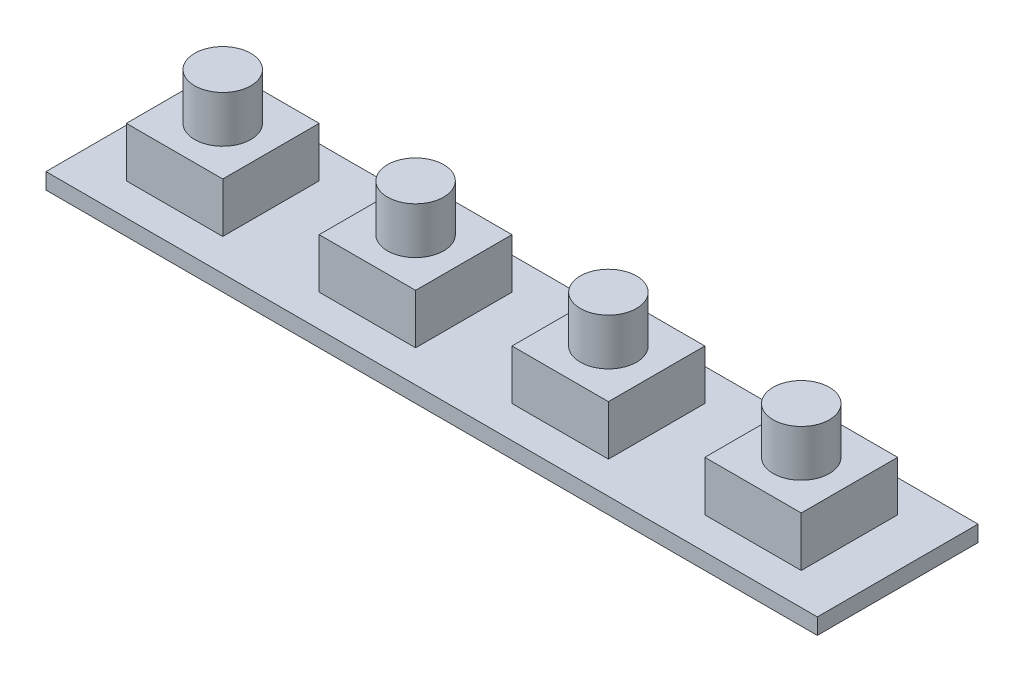
from build123d import *

# Parameters (mm, degrees)
SKETCH1_W           = 48
SKETCH1_H           = 10
BOSS_EXTRUDE1_DEPTH = 1
SKETCH2_W           = 6
SKETCH2_H           = 6
BOSS_EXTRUDE2_DEPTH = 3
SKETCH2_2_W         = 6
SKETCH2_2_H         = 6
BOSS_EXTRUDE3_DEPTH = 3.1
SKETCH4_R           = 1.75
BOSS_EXTRUDE4_DEPTH = 2.9


with BuildPart() as part:
    # Sketch1 → Boss-Extrude1 (new body)
    with BuildSketch(Plane(origin=(0, 0, 0), x_dir=(1, 0, 0), z_dir=(0, 1, 0))):
        Rectangle(SKETCH1_W, SKETCH1_H)
    extrude(amount=BOSS_EXTRUDE1_DEPTH)

    # Sketch2 → Boss-Extrude2 (add)
    with BuildSketch(Plane(origin=(0, 1, 0), x_dir=(1, 0, 0), z_dir=(0, 1, 0))):
        with Locations((-6, 0)):
            Rectangle(SKETCH2_W, SKETCH2_H)
        with Locations((-18, 0)):
            Rectangle(SKETCH2_W, SKETCH2_H)
        with Locations((6, 0)):
            Rectangle(SKETCH2_W, SKETCH2_H)
        with Locations((18, 0)):
            Rectangle(SKETCH2_W, SKETCH2_H)
    extrude(amount=BOSS_EXTRUDE2_DEPTH)

    # Sketch2<2> → Boss-Extrude3 (add)
    with BuildSketch(Plane(origin=(0, 1, 0), x_dir=(1, 0, 0), z_dir=(0, 1, 0))):
        with Locations((-6, 0)):
            Rectangle(SKETCH2_2_W, SKETCH2_2_H)
        with Locations((-18, 0)):
            Rectangle(SKETCH2_2_W, SKETCH2_2_H)
        with Locations((6, 0)):
            Rectangle(SKETCH2_2_W, SKETCH2_2_H)
        with Locations((18, 0)):
            Rectangle(SKETCH2_2_W, SKETCH2_2_H)
    extrude(amount=BOSS_EXTRUDE3_DEPTH)

    # Sketch4 → Boss-Extrude4 (add)
    with BuildSketch(Plane(origin=(0, 4.1, 0), x_dir=(1, 0, 0), z_dir=(0, 1, 0))):
        with Locations((-18, 0)):
            Circle(SKETCH4_R)
        with Locations((-6, 0)):
            Circle(SKETCH4_R)
        with Locations((6, 0)):
            Circle(SKETCH4_R)
        with Locations((18, 0)):
            Circle(SKETCH4_R)
    extrude(amount=BOSS_EXTRUDE4_DEPTH)


solid = part.part
